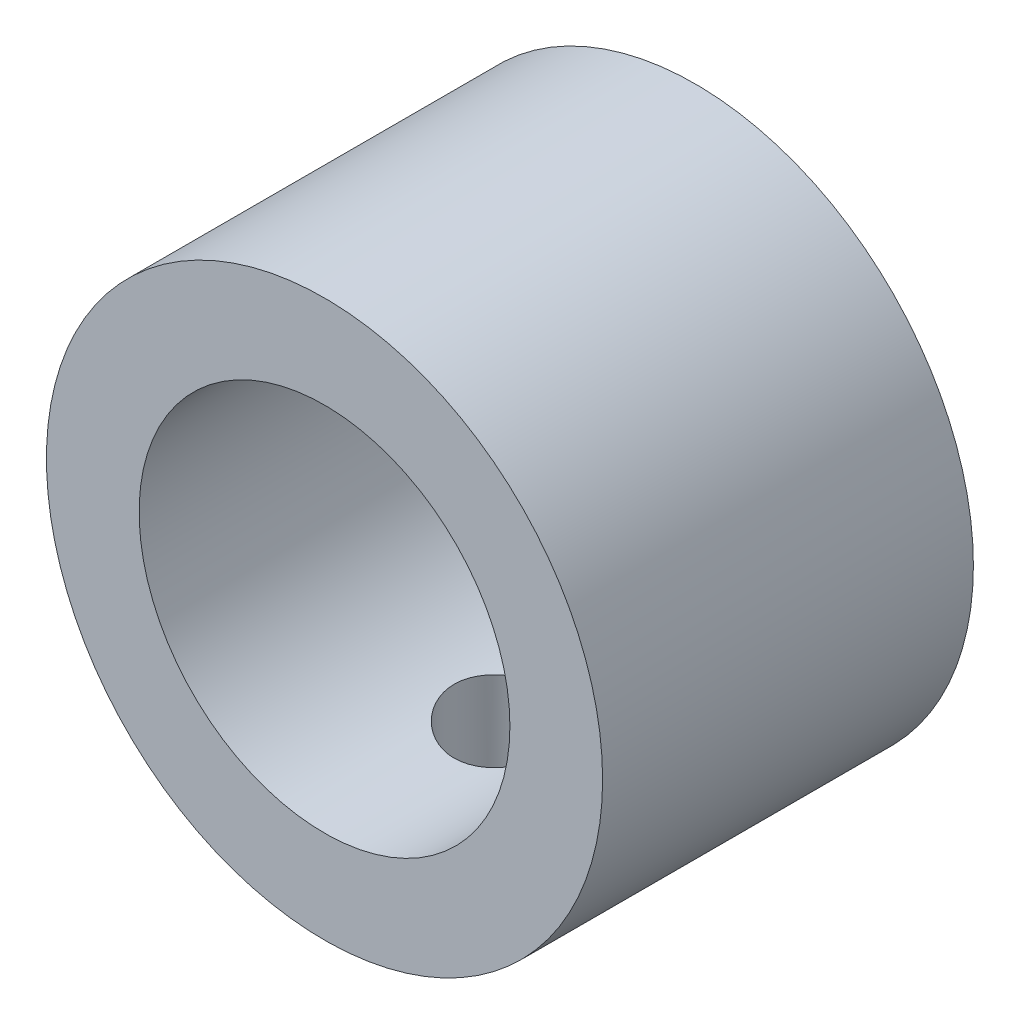
from build123d import *

# Parameters (mm, degrees)
SKETCH1_R           = 7.5
SKETCH1_R_2         = 5
BOSS_EXTRUDE1_DEPTH = 5
SKETCH3_R           = 1.5
CUT_EXTRUDE1_DEPTH  = 12.7260394


with BuildPart() as part:
    # Sketch1 → Boss-Extrude1 (new, symmetric)
    with BuildSketch(Plane.XY):
        Circle(SKETCH1_R)
        Circle(SKETCH1_R_2, mode=Mode.SUBTRACT)
    extrude(amount=BOSS_EXTRUDE1_DEPTH, both=True)

    # Sketch3 → Cut-Extrude1 (cut, through all)
    with BuildSketch(Plane(origin=(0, 0, 0), x_dir=(1, 0, 0), z_dir=(0, 1, 0))):
        with Locations(Location((0, 0, 0), (0, 0, 270))):
            Circle(SKETCH3_R)
    extrude(amount=-CUT_EXTRUDE1_DEPTH, mode=Mode.SUBTRACT)


solid = part.part
